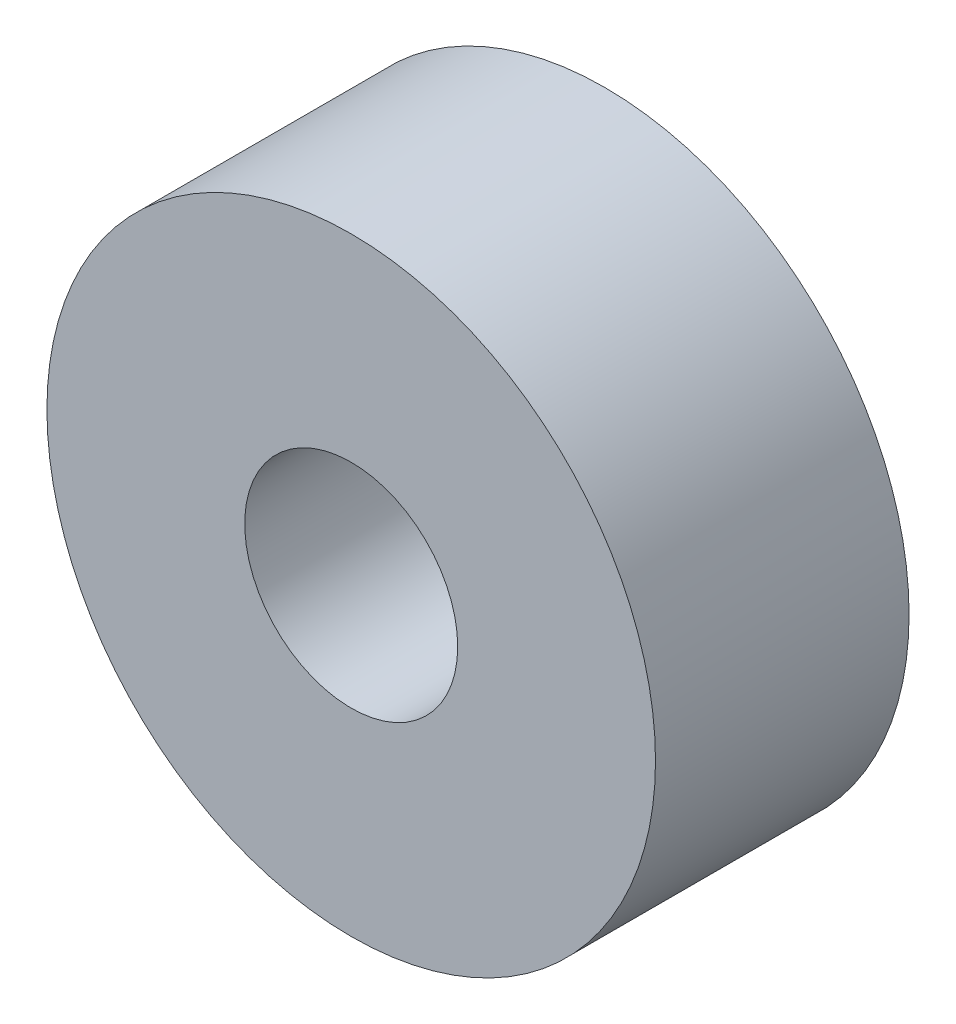
from build123d import *

# Parameters (mm, degrees)
SKETCH1_R           = 6
SKETCH1_R_2         = 2.1
BOSS_EXTRUDE1_DEPTH = 5


with BuildPart() as part:
    # Sketch1 → Boss-Extrude1 (new body)
    with BuildSketch(Plane.XY):
        Circle(SKETCH1_R)
        Circle(SKETCH1_R_2, mode=Mode.SUBTRACT)
    extrude(amount=BOSS_EXTRUDE1_DEPTH)


solid = part.part
